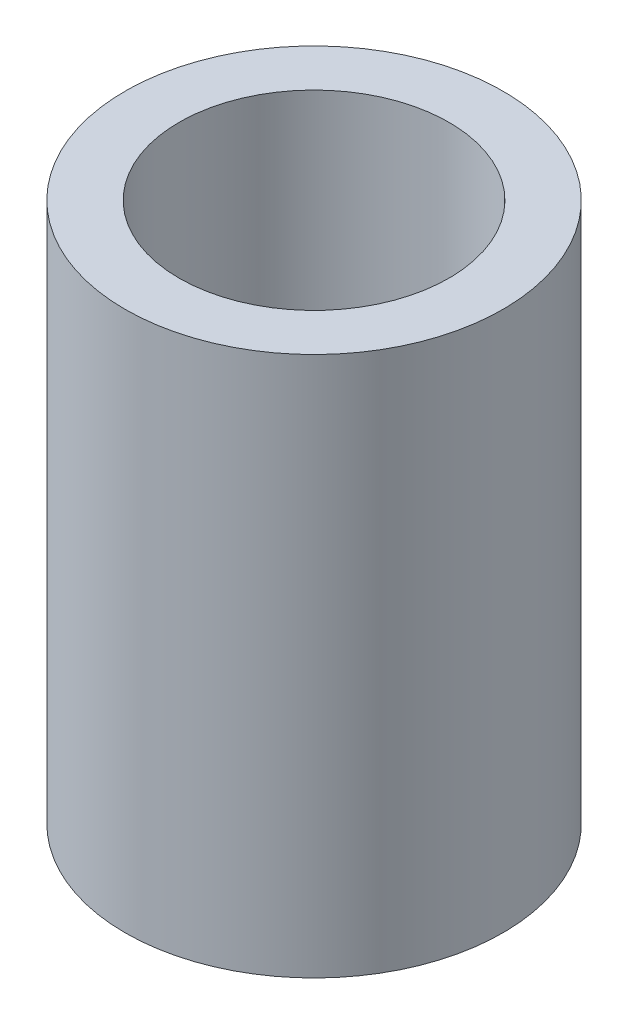
from build123d import *

# Parameters (mm, degrees)
SKETCH_1_R      = 2.1
SKETCH_1_R_2    = 1.5
EXTRUDE_1_DEPTH = 3


with BuildPart() as part:
    # 草图1 → 凸台-拉伸1 (new, symmetric)
    with BuildSketch(Plane(origin=(0, 0, 0), x_dir=(1, 0, 0), z_dir=(0, 1, 0))):
        with Locations(Location((0, 0, 0), (0, 0, 270))):
            Circle(SKETCH_1_R)
        with Locations(Location((0, 0, 0), (0, 0, 270))):
            Circle(SKETCH_1_R_2, mode=Mode.SUBTRACT)
    extrude(amount=EXTRUDE_1_DEPTH, both=True)


solid = part.part
